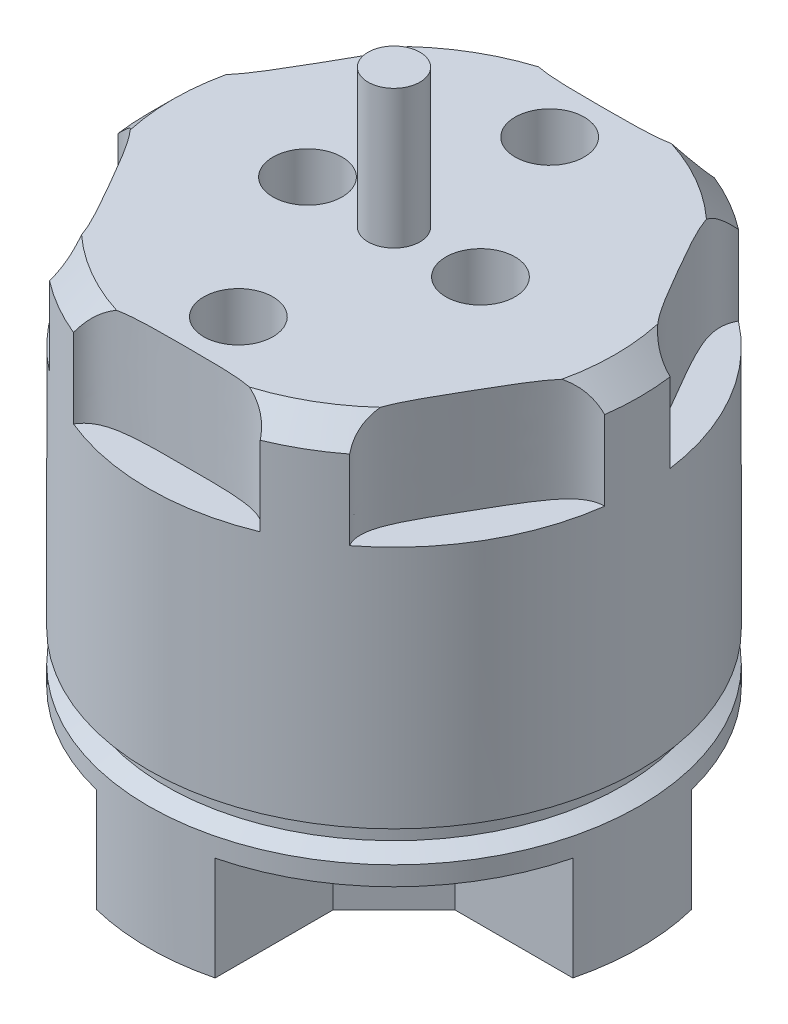
from build123d import *

# Parameters (mm, degrees)
SKETCH3_R          = 1
CUT_EXTRUDE1_DEPTH = 3
CUT_EXTRUDE2_START = -4
SKETCH4_R          = 1
CUT_EXTRUDE2_DEPTH = 4
CUT_EXTRUDE3_START = -3
CUT_EXTRUDE3_DEPTH = 3
CUT_EXTRUDE4_DEPTH = 3


with BuildPart() as part:
    # Sketch1 → Revolve1 (revolve)
    with BuildSketch(Plane(origin=(0, 0, 0), x_dir=(0, 0, -1), z_dir=(1, 0, 0)), mode=Mode.PRIVATE) as revolve1_sk:
        Polygon((0, 18.5), (-0.75, 18.5), (-0.75, 14.5), (-6.392893219, 14.5), (-7.1, 13.792893219), (-7.1, 0), (-1, 0), (-1, -1), (0, -1), (0, 0), align=None)
    revolve(revolve1_sk.sketch.rotate(Axis((0, 0, 0), (0, 1, 0)), 180), axis=Axis((0, 0, 0), (0, 1, 0)))

    # Sketch3 → Cut-Extrude1 (cut)
    with BuildSketch(Plane.XZ):
        with Locations(Location((0, 4.5, 0), (0, 0, 270))):
            Circle(SKETCH3_R)
        with Locations(Location((4.5, 0, 0), (0, 0, 270))):
            Circle(SKETCH3_R)
        with Locations(Location((-4.5, 0, 0), (0, 0, 270))):
            Circle(SKETCH3_R)
        with Locations(Location((0, -4.5, 0), (0, 0, 270))):
            Circle(SKETCH3_R)
    extrude(amount=-CUT_EXTRUDE1_DEPTH, mode=Mode.SUBTRACT)

    # Sketch4 → Cut-Extrude2 (cut)
    with BuildSketch(Plane(origin=(0, 14.5, 0), x_dir=(1, 0, 0), z_dir=(0, 1, 0)).offset(CUT_EXTRUDE2_START)):
        with Locations(Location((0, 4.5, 0), (0, 0, 90))):
            Circle(SKETCH4_R)
        with Locations(Location((2.5, 0, 0), (0, 0, 270))):
            Circle(SKETCH4_R)
        with Locations(Location((0, -4.5, 0), (0, 0, 90))):
            Circle(SKETCH4_R)
        with Locations(Location((-2.5, 0, 0), (0, 0, 270))):
            Circle(SKETCH4_R)
    extrude(amount=CUT_EXTRUDE2_DEPTH, mode=Mode.SUBTRACT)

    # Sketch5 → Cut-Extrude3 (cut)
    with BuildSketch(Plane(origin=(0, 14.5, 0), x_dir=(1, 0, 0), z_dir=(0, 1, 0)).offset(CUT_EXTRUDE3_START)):
        with BuildLine():
            ThreePointArc((-2.7, 6.566582064), (0, 7.1), (2.7, 6.566582064))
            add(Edge.make_bspline(
                [(-2.7, 6.566582064), (-2.071231518, 5.5), (0, 6.5), (2.071231518, 5.5), (2.7, 6.566582064)],
                knots=[0, 0, 0, 0, 0, 1, 1, 1, 1, 1], degree=4))
        make_face()
        with BuildLine():
            ThreePointArc((4.336826883, 5.621559622), (6.148780367, 3.55), (7.036826883, 0.945022442))
            add(Edge.make_bspline(
                [(4.336826883, 5.621559622), (3.727523962, 4.543739111), (5.629165125, 3.25), (5.79875548, 0.956260889), (7.036826883, 0.945022442)],
                knots=[0, 0, 0, 0, 0, 1, 1, 1, 1, 1], degree=4))
        make_face()
        with BuildLine():
            ThreePointArc((7.036826883, -0.945022442), (6.148780367, -3.55), (4.336826883, -5.621559622))
            add(Edge.make_bspline(
                [(7.036826883, -0.945022442), (5.79875548, -0.956260889), (5.629165125, -3.25), (3.727523962, -4.543739111), (4.336826883, -5.621559622)],
                knots=[0, 0, 0, 0, 0, 1, 1, 1, 1, 1], degree=4))
        make_face()
        with BuildLine():
            ThreePointArc((2.7, -6.566582064), (0, -7.1), (-2.7, -6.566582064))
            add(Edge.make_bspline(
                [(2.7, -6.566582064), (2.071231518, -5.5), (0, -6.5), (-2.071231518, -5.5), (-2.7, -6.566582064)],
                knots=[0, 0, 0, 0, 0, 1, 1, 1, 1, 1], degree=4))
        make_face()
        with BuildLine():
            ThreePointArc((-4.336826883, -5.621559622), (-6.148780367, -3.55), (-7.036826883, -0.945022442))
            add(Edge.make_bspline(
                [(-4.336826883, -5.621559622), (-3.727523962, -4.543739111), (-5.629165125, -3.25), (-5.79875548, -0.956260889), (-7.036826883, -0.945022442)],
                knots=[0, 0, 0, 0, 0, 1, 1, 1, 1, 1], degree=4))
        make_face()
        with BuildLine():
            ThreePointArc((-7.036826883, 0.945022442), (-6.148780367, 3.55), (-4.336826883, 5.621559622))
            add(Edge.make_bspline(
                [(-7.036826883, 0.945022442), (-5.79875548, 0.956260889), (-5.629165125, 3.25), (-3.727523962, 4.543739111), (-4.336826883, 5.621559622)],
                knots=[0, 0, 0, 0, 0, 1, 1, 1, 1, 1], degree=4))
        make_face()
    extrude(amount=CUT_EXTRUDE3_DEPTH, mode=Mode.SUBTRACT)

    # Sketch6 → Cut-Extrude4 (cut)
    with BuildSketch(Plane.XZ):
        with BuildLine():
            Line((-1.718410499, 6.888908866), (-1.718410499, 3.486177452))
            Line((-1.718410499, 3.486177452), (-3.486177452, 1.718410499))
            Line((-3.486177452, 1.718410499), (-6.888908866, 1.718410499))
            ThreePointArc((-6.888908866, 1.718410499), (-5.020458146, 5.020458146), (-1.718410499, 6.888908866))
        make_face()
        with BuildLine():
            Line((1.718410499, 3.486177452), (1.718410499, 6.888908866))
            ThreePointArc((1.718410499, 6.888908866), (5.020458146, 5.020458146), (6.888908866, 1.718410499))
            Line((6.888908866, 1.718410499), (3.486177452, 1.718410499))
            Line((3.486177452, 1.718410499), (1.718410499, 3.486177452))
        make_face()
        with BuildLine():
            Line((3.486177452, -1.718410499), (6.888908866, -1.718410499))
            ThreePointArc((6.888908866, -1.718410499), (5.020458146, -5.020458146), (1.718410499, -6.888908866))
            Line((1.718410499, -6.888908866), (1.718410499, -3.486177452))
            Line((1.718410499, -3.486177452), (3.486177452, -1.718410499))
        make_face()
        with BuildLine():
            Line((-1.718410499, -3.486177452), (-1.718410499, -6.888908866))
            ThreePointArc((-1.718410499, -6.888908866), (-5.020458146, -5.020458146), (-6.888908866, -1.718410499))
            Line((-6.888908866, -1.718410499), (-3.486177452, -1.718410499))
            Line((-3.486177452, -1.718410499), (-1.718410499, -3.486177452))
        make_face()
    extrude(amount=-CUT_EXTRUDE4_DEPTH, mode=Mode.SUBTRACT)

    # Sketch7 → Cut-Revolve1 (revolve, cut)
    with BuildSketch(Plane(origin=(0, 0, 0), x_dir=(0, 0, -1), z_dir=(1, 0, 0)), mode=Mode.PRIVATE) as cut_revolve1_sk:
        Polygon((-7.1, 3.55), (-6.6, 3.8), (-6.6, 4.2), (-7.1, 4.45), align=None)
    revolve(cut_revolve1_sk.sketch.rotate(Axis((0, 0, 0), (0, 1, 0)), 180), axis=Axis((0, 0, 0), (0, 1, 0)), mode=Mode.SUBTRACT)


solid = part.part
